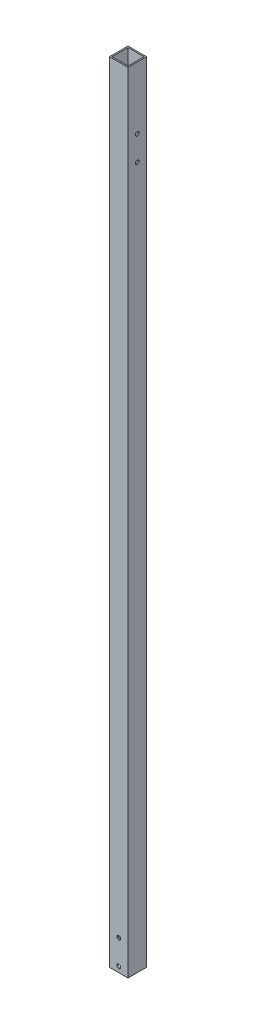
from build123d import *

# Parameters (mm, degrees)
SKETCH_1_W          = 15
SKETCH_1_H          = 15
SKETCH_1_W_2        = 13
SKETCH_1_H_2        = 13
EXTRUDE_1_DEPTH     = 640
SKETCH_2_R          = 1.6
CUT_EXTRUDE_1_DEPTH = 641.219688857
SKETCH_3_R          = 1.6
CUT_EXTRUDE_2_DEPTH = 641.219688857


with BuildPart() as part:
    # 草图1 → 拉伸-薄壁1 (new body)
    with BuildSketch(Plane(origin=(0, 0, 0), x_dir=(1, 0, 0), z_dir=(0, 1, 0))):
        Rectangle(SKETCH_1_W, SKETCH_1_H)
        Rectangle(SKETCH_1_W_2, SKETCH_1_H_2, mode=Mode.SUBTRACT)
    extrude(amount=EXTRUDE_1_DEPTH)

    # 草图2 → 切除-拉伸1 (cut, through all)
    with BuildSketch(Plane.XY.offset(7.5)):
        with Locations((0, 4.5)):
            Circle(SKETCH_2_R)
        with Locations((0, 24.5)):
            Circle(SKETCH_2_R)
    extrude(amount=-CUT_EXTRUDE_1_DEPTH, mode=Mode.SUBTRACT)

    # 草图3 → 切除-拉伸2 (cut, through all)
    with BuildSketch(Plane(origin=(7.5, 0, 0), x_dir=(0, 0, -1), z_dir=(1, 0, 0))):
        with Locations((0, 589.5)):
            Circle(SKETCH_3_R)
        with Locations((0, 569.5)):
            Circle(SKETCH_3_R)
    extrude(amount=-CUT_EXTRUDE_2_DEPTH, mode=Mode.SUBTRACT)


solid = part.part
